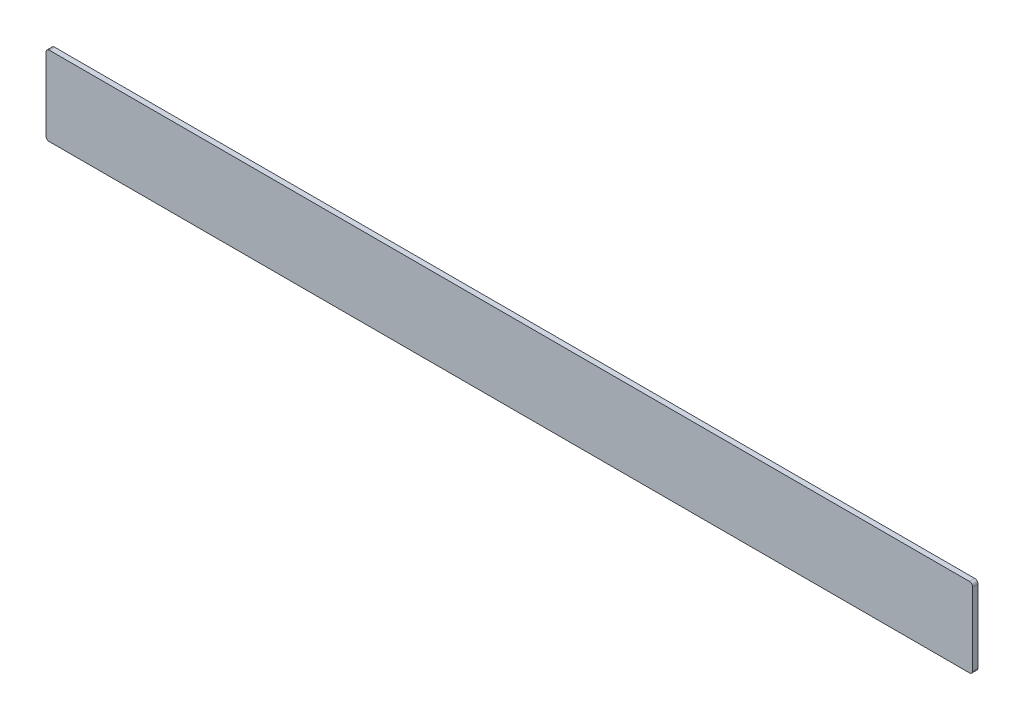
from build123d import *

# Parameters (mm, degrees)
BOSS_EXTRUDE1_DEPTH = 4


with BuildPart() as part:
    # Sketch1 → Boss-Extrude1 (new, symmetric)
    with BuildSketch(Plane.XY):
        with BuildLine():
            Line((-697, -60), (697, -60))
            ThreePointArc((697, -60), (700.535533906, -58.535533906), (702, -55))
            Line((702, -55), (702, 55))
            ThreePointArc((702, 55), (700.535533906, 58.535533906), (697, 60))
            Line((697, 60), (-697, 60))
            ThreePointArc((-697, 60), (-700.535533906, 58.535533906), (-702, 55))
            Line((-702, 55), (-702, -55))
            ThreePointArc((-702, -55), (-700.535533906, -58.535533906), (-697, -60))
        make_face()
    extrude(amount=BOSS_EXTRUDE1_DEPTH, both=True)


solid = part.part
